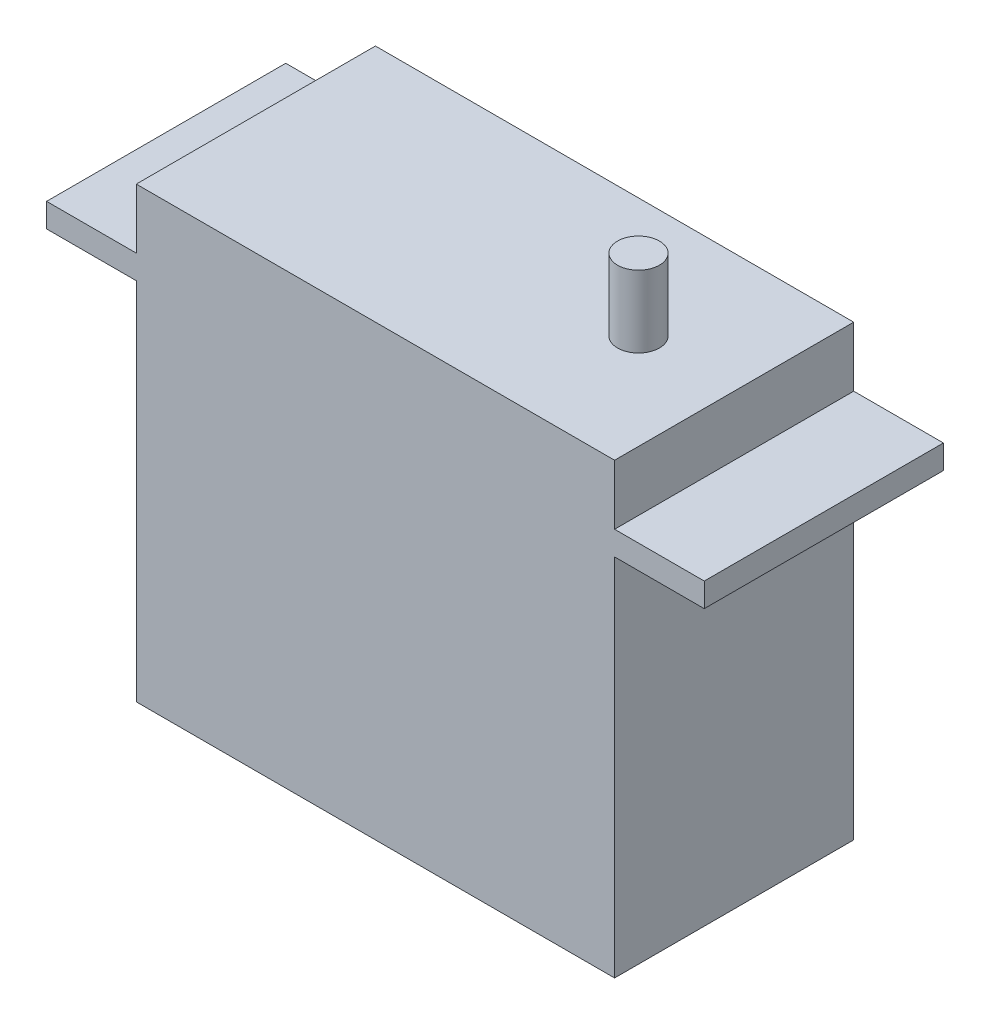
from build123d import *

# Parameters (mm, degrees)
SKETCH1_W           = 40
SKETCH1_H           = 20
BOSS_EXTRUDE1_DEPTH = 37.5
SKETCH2_W           = 20
SKETCH2_H           = 2
BOSS_EXTRUDE2_DEPTH = 7.5
SKETCH3_W           = 20
SKETCH3_H           = 2
BOSS_EXTRUDE3_DEPTH = 7.5
SKETCH4_R           = 1.75
BOSS_EXTRUDE4_DEPTH = 6


with BuildPart() as part:
    # Sketch1 → Boss-Extrude1 (new body)
    with BuildSketch(Plane(origin=(0, 0, 0), x_dir=(1, 0, 0), z_dir=(0, 1, 0))):
        with Locations((20, -10)):
            Rectangle(SKETCH1_W, SKETCH1_H)
    extrude(amount=BOSS_EXTRUDE1_DEPTH)

    # Sketch2 → Boss-Extrude2 (add)
    with BuildSketch(Plane(origin=(40, 0, 0), x_dir=(0, 0, -1), z_dir=(1, 0, 0))):
        with Locations((-10, 31.5)):
            Rectangle(SKETCH2_W, SKETCH2_H)
    extrude(amount=BOSS_EXTRUDE2_DEPTH)

    # Sketch3 → Boss-Extrude3 (add)
    with BuildSketch(Plane.ZY):
        with Locations((10, 31.5)):
            Rectangle(SKETCH3_W, SKETCH3_H)
    extrude(amount=BOSS_EXTRUDE3_DEPTH)

    # Sketch4 → Boss-Extrude4 (add)
    with BuildSketch(Plane(origin=(0, 37.5, 0), x_dir=(1, 0, 0), z_dir=(0, 1, 0))):
        with Locations(Location((32, -10, 0), (0, 0, 270))):
            Circle(SKETCH4_R)
    extrude(amount=BOSS_EXTRUDE4_DEPTH)


solid = part.part
